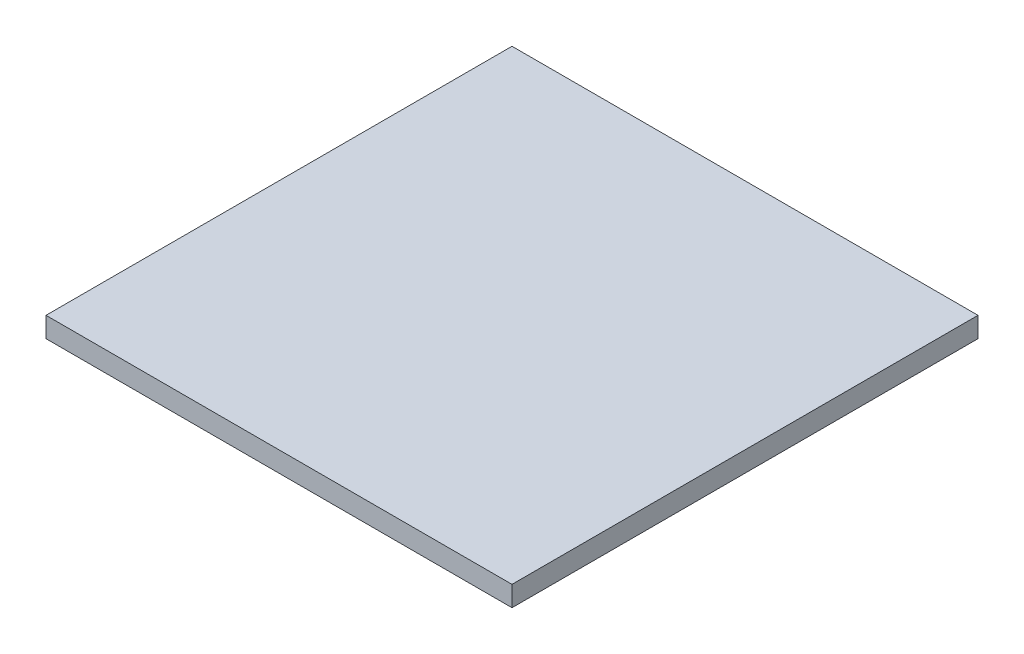
from build123d import *

# Parameters (mm, degrees)
SKETCH1_W           = 276
SKETCH1_H           = 276
BOSS_EXTRUDE1_DEPTH = 12


with BuildPart() as part:
    # Sketch1 → Boss-Extrude1 (new body)
    with BuildSketch(Plane(origin=(0, 0, 0), x_dir=(1, 0, 0), z_dir=(0, 1, 0))):
        with Locations((138, 138)):
            Rectangle(SKETCH1_W, SKETCH1_H)
    extrude(amount=BOSS_EXTRUDE1_DEPTH)


solid = part.part
